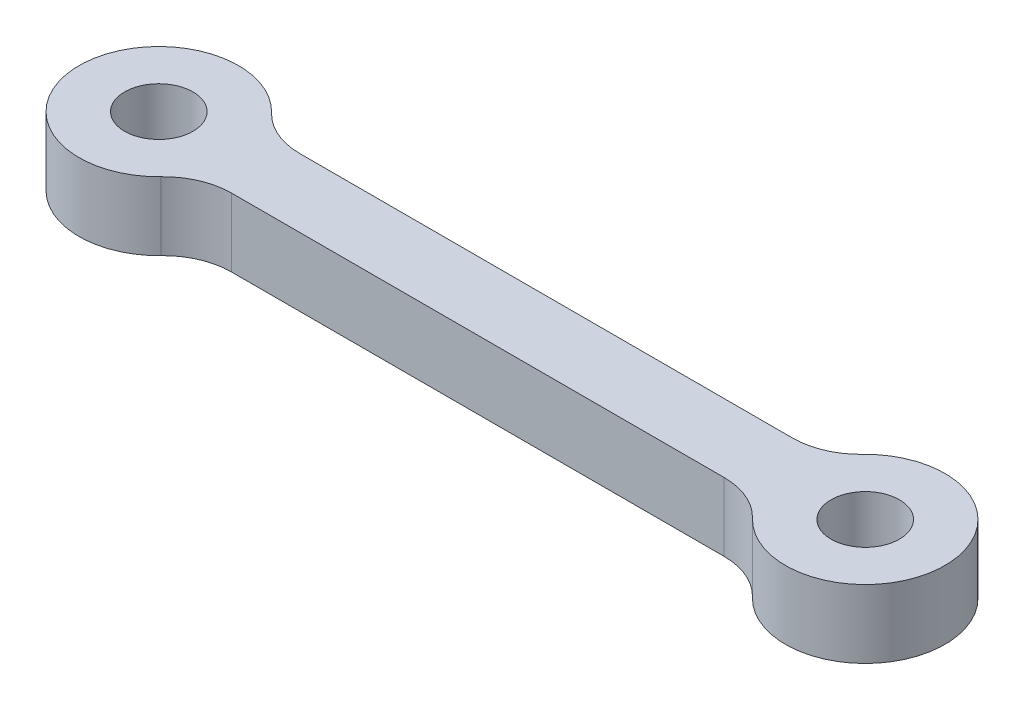
from build123d import *

# Parameters (mm, degrees)
SKETCH1_R           = 1.5
BOSS_EXTRUDE1_DEPTH = 3
FILLET1_R           = 3
SCALE1_SCALE        = 0.888888889


with BuildPart() as part:
    # Sketch1 → Boss-Extrude1 (new body)
    with BuildSketch(Plane(origin=(0, 0, 0), x_dir=(1, 0, 0), z_dir=(0, 1, 0))):
        with BuildLine():
            ThreePointArc((3.16227766, 1.5), (-3.5, 0), (3.16227766, -1.5))
            Line((3.16227766, -1.5), (27.83772234, -1.5))
            ThreePointArc((27.83772234, -1.5), (34.5, 0), (27.83772234, 1.5))
            Line((27.83772234, 1.5), (3.16227766, 1.5))
        make_face()
        with Locations(Location((0, 0, 0), (0, 0, 270))):
            Circle(SKETCH1_R, mode=Mode.SUBTRACT)
        with Locations(Location((31, 0, 0), (0, 0, 270))):
            Circle(SKETCH1_R, mode=Mode.SUBTRACT)
    extrude(amount=BOSS_EXTRUDE1_DEPTH)

    # Fillet1
    fillet1_edges = [part.edges().sort_by_distance(p)[0] for p in [
        (27.83772234, 1.5, 1.5),
        (3.16227766, 1.5, 1.5),
        (3.16227766, 1.5, -1.5),
        (27.83772234, 1.5, -1.5),
    ]]
    fillet(fillet1_edges, radius=FILLET1_R)


with BuildPart() as part_1:
    # Scale1: scaled about (15.5, 1.5, 0)
    add(part.part.scale(SCALE1_SCALE).moved(Location((1.722222222, 0.166666667, 0))))


solid = part_1.part
